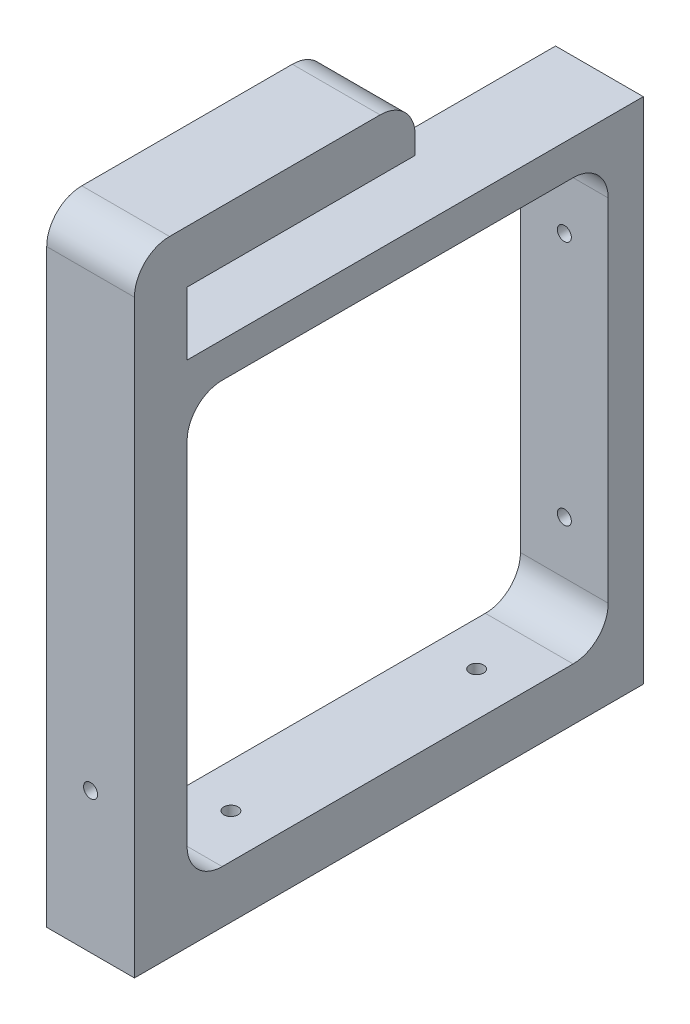
from build123d import *

# Parameters (mm, degrees)
ESQUISSE1_W             = 120
ESQUISSE1_H             = 120
BOSS_EXTRU_1_DEPTH      = 25
ESQUISSE2_R             = 2
ENL_V_MAT_EXTRU_1_DEPTH = 220.588251052
ESQUISSE3_R             = 2
ENL_V_MAT_EXTRU_2_DEPTH = 225.797686821
ESQUISSE4_R             = 2
ENL_V_MAT_EXTRU_3_DEPTH = 222.831016767
CONG_1_R                = 10
CONG_2_R                = 10


with BuildPart() as part:
    # Esquisse1 → Boss.-Extru.1 (new body)
    with BuildSketch(Plane(origin=(0, 0, 0), x_dir=(0, 0, -1), z_dir=(1, 0, 0))):
        Polygon((0, 0), (145, 0), (145, 145), (15, 145), (15, 163), (80, 163), (80, 178), (0, 178), align=None)
        with Locations((75, 75)):
            Rectangle(ESQUISSE1_W, ESQUISSE1_H, mode=Mode.SUBTRACT)
    extrude(amount=BOSS_EXTRU_1_DEPTH)

    # Esquisse2 → Enlèv. mat.-Extru.1 (cut, through all)
    with BuildSketch(Plane(origin=(0, 15, 0), x_dir=(1, 0, 0), z_dir=(0, 1, 0))):
        with Locations(Location((12.5, 40, 0), (0, 0, 270))):
            Circle(ESQUISSE2_R)
        with Locations(Location((12.5, 110, 0), (0, 0, 270))):
            Circle(ESQUISSE2_R)
    extrude(amount=-ENL_V_MAT_EXTRU_1_DEPTH, mode=Mode.SUBTRACT)

    # Esquisse3 → Enlèv. mat.-Extru.2 (cut, through all)
    with BuildSketch(Plane.XY.offset(-135)):
        with Locations((12.5, 40)):
            Circle(ESQUISSE3_R)
        with Locations((12.5, 110)):
            Circle(ESQUISSE3_R)
    extrude(amount=-ENL_V_MAT_EXTRU_2_DEPTH, mode=Mode.SUBTRACT)

    # Esquisse4 → Enlèv. mat.-Extru.3 (cut, through all)
    with BuildSketch(Plane(origin=(0, 0, -15), x_dir=(-1, 0, 0), z_dir=(0, 0, -1))):
        with Locations(Location((-12.5, 40, 0), (0, 0, 180))):
            Circle(ESQUISSE4_R)
    extrude(amount=-ENL_V_MAT_EXTRU_3_DEPTH, mode=Mode.SUBTRACT)

    # Congé1
    cong_1_edges = [part.edges().sort_by_distance(p)[0] for p in [
        (12.5, 178, 0),
        (12.5, 178, -80),
    ]]
    fillet(cong_1_edges, radius=CONG_1_R)

    # Congé2
    cong_2_edges = [part.edges().sort_by_distance(p)[0] for p in [
        (12.5, 135, -135),
        (12.5, 135, -15),
        (12.5, 15, -15),
        (12.5, 15, -135),
    ]]
    fillet(cong_2_edges, radius=CONG_2_R)


solid = part.part
